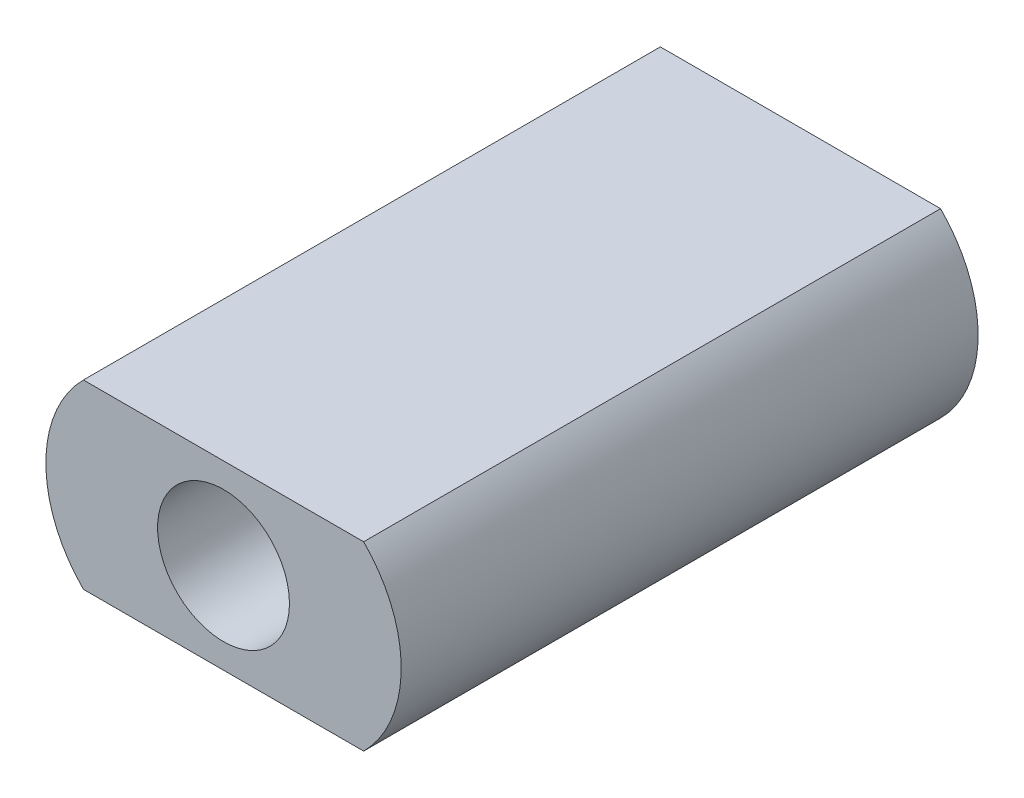
from build123d import *

# Parameters (mm, degrees)
SALIENTE_EXTRUIR1_DEPTH = 17.5
CROQUIS2_R              = 4
CORTAR_EXTRUIR1_DEPTH   = 20


with BuildPart() as part:
    # Croquis1 → Saliente-Extruir1 (new, symmetric)
    with BuildSketch(Plane.XY):
        with BuildLine():
            Line((8.5, -5.5), (-8.5, -5.5))
            ThreePointArc((-8.5, -5.5), (-10.778174593, 0), (-8.5, 5.5))
            Line((-8.5, 5.5), (8.5, 5.5))
            ThreePointArc((8.5, 5.5), (10.778174593, 0), (8.5, -5.5))
        make_face()
    extrude(amount=SALIENTE_EXTRUIR1_DEPTH, both=True)

    # Croquis2 → Cortar-Extruir1 (cut)
    with BuildSketch(Plane.XY.offset(17.5)):
        Circle(CROQUIS2_R)
    extrude(amount=-CORTAR_EXTRUIR1_DEPTH, mode=Mode.SUBTRACT)


solid = part.part
